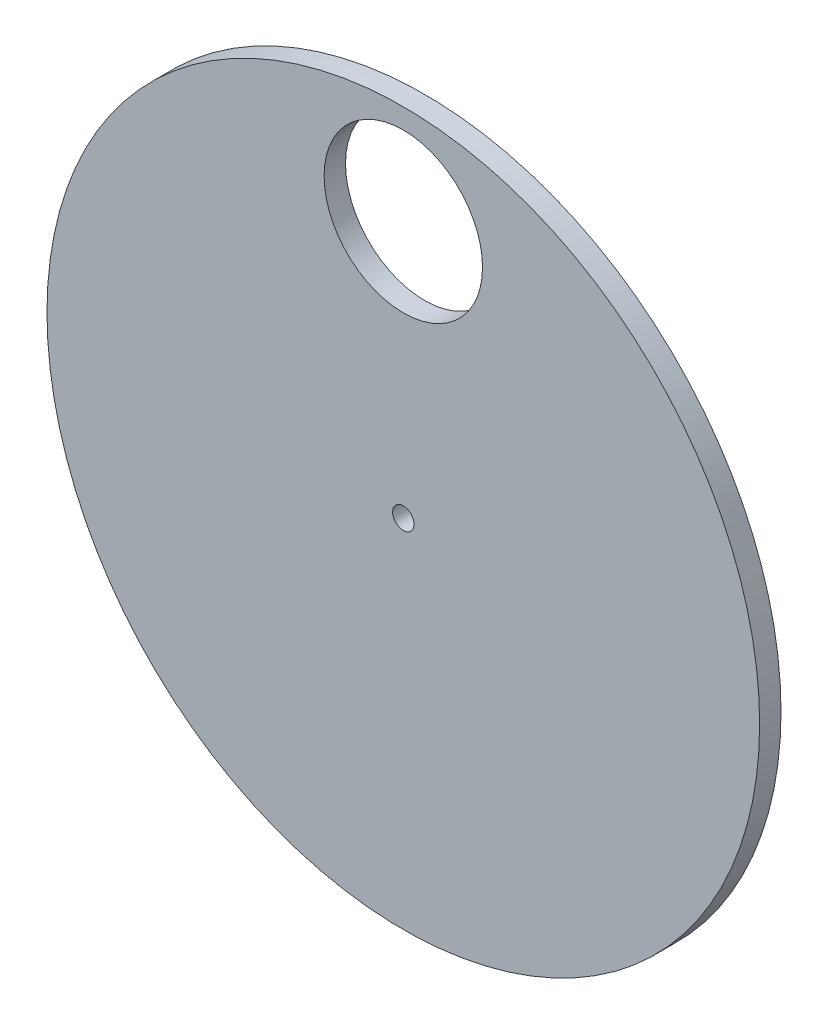
from build123d import *

# Parameters (mm, degrees)
SKETCH1_R           = 100
BOSS_EXTRUDE1_DEPTH = 6
SKETCH2_R           = 3
CUT_EXTRUDE1_DEPTH  = 6
SKETCH3_R           = 22.225
CUT_EXTRUDE2_DEPTH  = 10


with BuildPart() as part:
    # Sketch1 → Boss-Extrude1 (new body)
    with BuildSketch(Plane.XY):
        Circle(SKETCH1_R)
    extrude(amount=BOSS_EXTRUDE1_DEPTH)

    # Sketch2 → Cut-Extrude1 (cut)
    with BuildSketch(Plane.XY.offset(6)):
        Circle(SKETCH2_R)
    extrude(amount=-CUT_EXTRUDE1_DEPTH, mode=Mode.SUBTRACT)

    # Sketch3 → Cut-Extrude2 (cut)
    with BuildSketch(Plane(origin=(0, 0, 0), x_dir=(-1, 0, 0), z_dir=(0, 0, -1))):
        with Locations((0, 72.110521326)):
            Circle(SKETCH3_R)
    extrude(amount=-CUT_EXTRUDE2_DEPTH, mode=Mode.SUBTRACT)


solid = part.part
